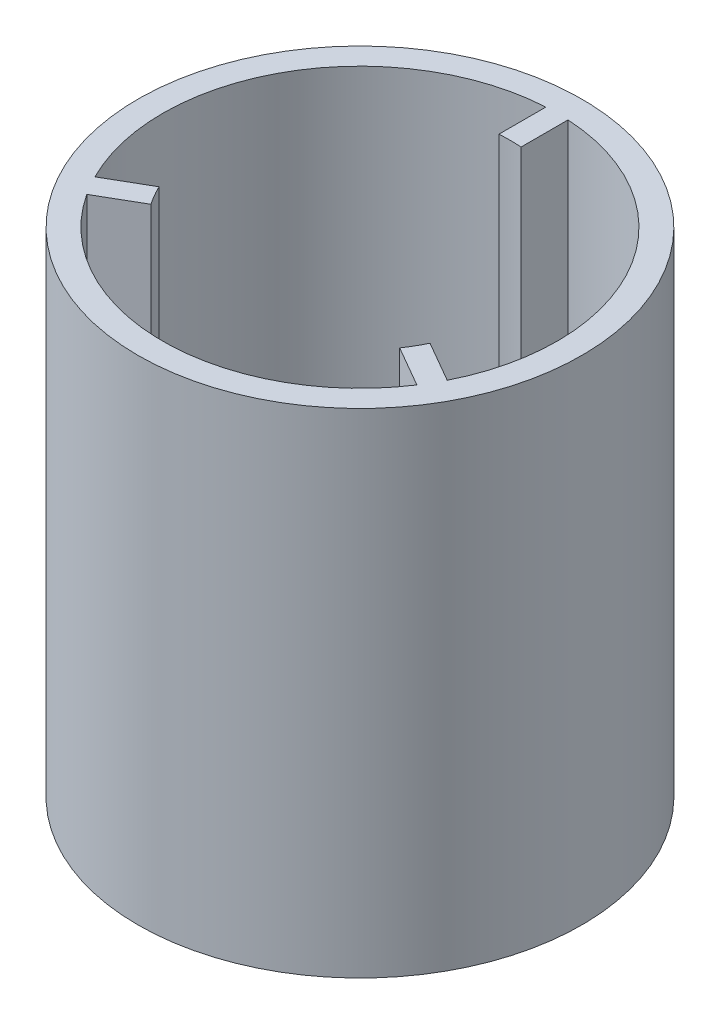
from build123d import *

# Parameters (mm, degrees)
SKETCH1_R           = 4.5
SKETCH1_R_2         = 4
BOSS_EXTRUDE1_DEPTH = 10
BOSS_EXTRUDE2_START = -10
BOSS_EXTRUDE2_DEPTH = 10


with BuildPart() as part:
    # Sketch1 → Boss-Extrude1 (new body)
    with BuildSketch(Plane(origin=(0, 0, 0), x_dir=(1, 0, 0), z_dir=(0, 1, 0))):
        with Locations(Location((0, 0, 0), (0, 0, 270))):
            Circle(SKETCH1_R)
        with Locations(Location((0, 0, 0), (0, 0, 270))):
            Circle(SKETCH1_R_2, mode=Mode.SUBTRACT)
    extrude(amount=BOSS_EXTRUDE1_DEPTH)

    # Sketch2 → Boss-Extrude2 (add)
    with BuildSketch(Plane(origin=(0, 10, 0), x_dir=(1, 0, 0), z_dir=(0, 1, 0)).offset(BOSS_EXTRUDE2_START)):
        with BuildLine():
            ThreePointArc((-0.225, 3.041689498), (0, 3.05), (0.225, 3.041689498))
            Line((0.225, 3.041689498), (0.225, 3.993666861))
            ThreePointArc((0.225, 3.993666861), (0, 4), (-0.225, 3.993666861))
            Line((-0.225, 3.993666861), (-0.225, 3.041689498))
        make_face()
        with BuildLine():
            Line((3.571116956, -1.801977715), (2.746680375, -1.325989033))
            ThreePointArc((2.746680375, -1.325989033), (2.641377482, -1.525), (2.521680375, -1.715700465))
            Line((2.521680375, -1.715700465), (3.346116956, -2.191689147))
            ThreePointArc((3.346116956, -2.191689147), (3.464101615, -2), (3.571116956, -1.801977715))
        make_face()
        with BuildLine():
            Line((-3.346116956, -2.191689147), (-2.521680375, -1.715700465))
            ThreePointArc((-2.521680375, -1.715700465), (-2.641377482, -1.525), (-2.746680375, -1.325989033))
            Line((-2.746680375, -1.325989033), (-3.571116956, -1.801977715))
            ThreePointArc((-3.571116956, -1.801977715), (-3.464101615, -2), (-3.346116956, -2.191689147))
        make_face()
    extrude(amount=BOSS_EXTRUDE2_DEPTH)


solid = part.part
